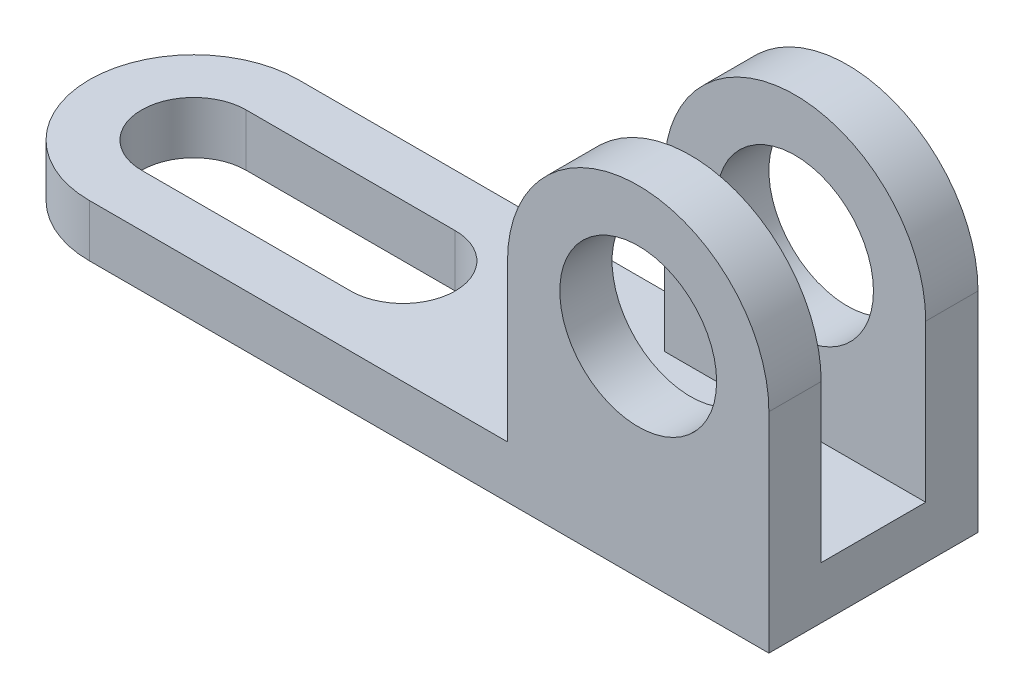
from build123d import *

# Parameters (mm, degrees)
BOSS_EXTRUDE1_DEPTH = 5
SKETCH2_R           = 15
BOSS_EXTRUDE2_DEPTH = 10


with BuildPart() as part:
    # Sketch1 → Boss-Extrude1 (new, symmetric)
    with BuildSketch(Plane(origin=(0, 0, 0), x_dir=(1, 0, 0), z_dir=(0, 1, 0))):
        with BuildLine():
            Line((65, -20), (-65, -20))
            ThreePointArc((-65, -20), (-85, 0), (-65, 20))
            Line((-65, 20), (65, 20))
            Line((65, 20), (65, -20))
        make_face()
        with BuildLine():
            Line((-65, 10), (-25, 10))
            ThreePointArc((-25, 10), (-15, 0), (-25, -10))
            Line((-25, -10), (-65, -10))
            ThreePointArc((-65, -10), (-75, 0), (-65, 10))
        make_face(mode=Mode.SUBTRACT)
    extrude(amount=BOSS_EXTRUDE1_DEPTH, both=True)

    # Sketch2 → Boss-Extrude2 (add)
    with BuildSketch(Plane.XY.offset(20)):
        with BuildLine():
            Line((65, 5), (15, 5))
            Line((15, 5), (15, 35))
            ThreePointArc((15, 35), (40, 60), (65, 35))
            Line((65, 35), (65, 5))
        make_face()
        with Locations((40, 35)):
            Circle(SKETCH2_R, mode=Mode.SUBTRACT)
    boss_extrude2 = extrude(amount=-BOSS_EXTRUDE2_DEPTH)

    # Mirror1: Boss-Extrude2 across plane
    add(boss_extrude2.mirror(Plane.XY))


solid = part.part
